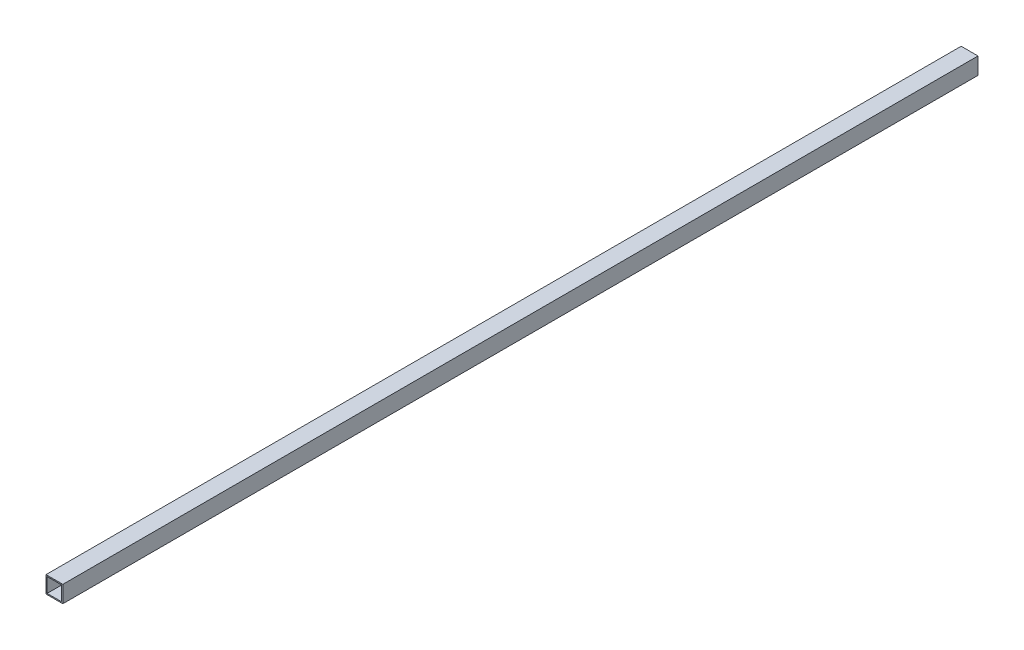
from build123d import *

# Parameters (mm, degrees)
SKETCH_1_W      = 15
SKETCH_1_H      = 15
SKETCH_1_W_2    = 13
SKETCH_1_H_2    = 13
EXTRUDE_1_DEPTH = 815


with BuildPart() as part:
    # 草图1 → 拉伸-薄壁1 (new body)
    with BuildSketch(Plane.XY):
        with Locations((7.5, -7.5)):
            Rectangle(SKETCH_1_W, SKETCH_1_H)
        with Locations((7.5, -7.5)):
            Rectangle(SKETCH_1_W_2, SKETCH_1_H_2, mode=Mode.SUBTRACT)
    extrude(amount=EXTRUDE_1_DEPTH)


solid = part.part
